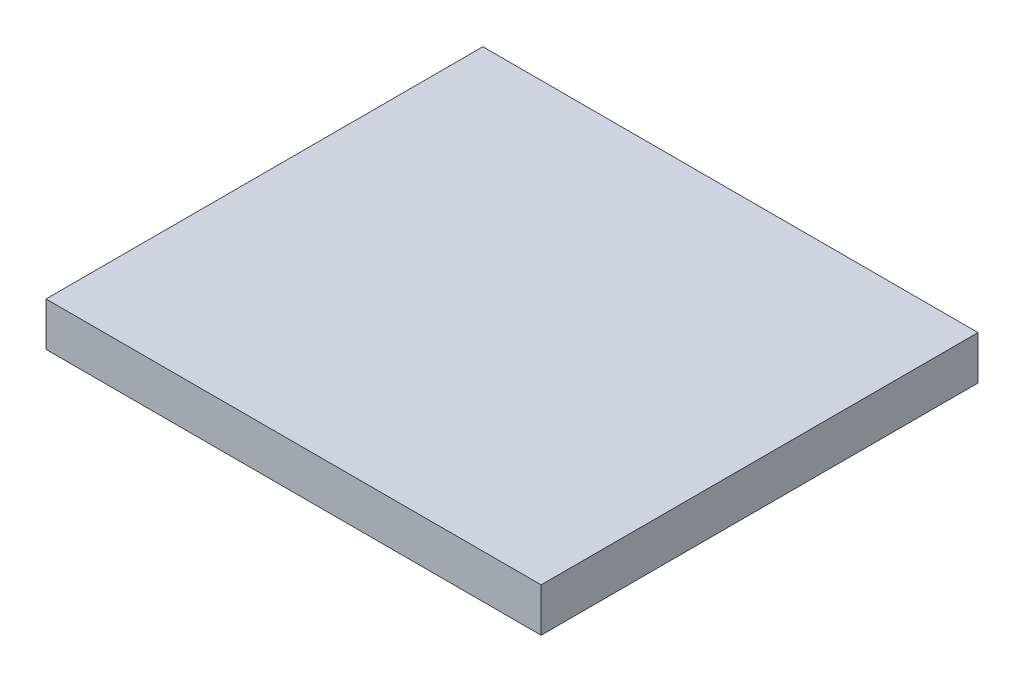
from build123d import *

# Parameters (mm, degrees)
SKETCH1_W    = 170
SKETCH1_H    = 15
MIDDLE_DEPTH = 150


with BuildPart() as part:
    # Sketch1 → middle (new body)
    with BuildSketch(Plane.XY):
        with Locations((45.862068966, -2.801724138)):
            Rectangle(SKETCH1_W, SKETCH1_H)
    extrude(amount=MIDDLE_DEPTH)


solid = part.part
